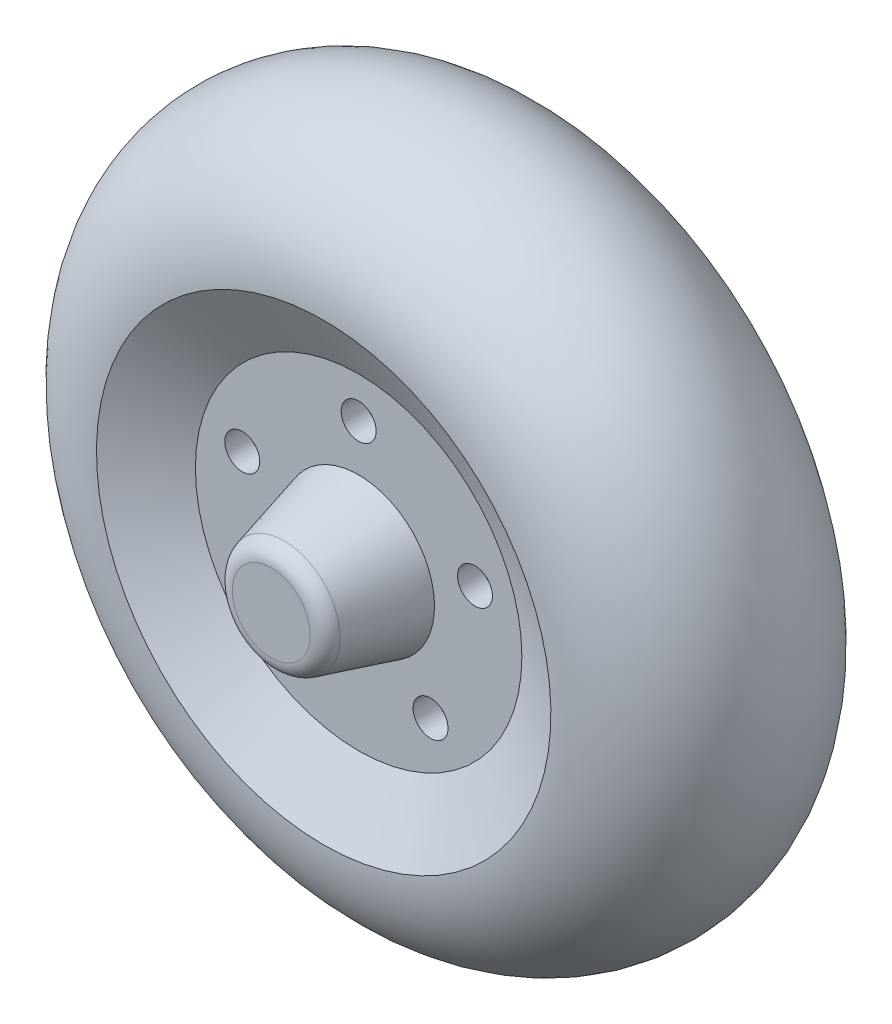
from build123d import *

# Parameters (mm, degrees)
CONG_1_R                = 5
ESQUISSE2_R             = 5
ENL_V_MAT_EXTRU_1_DEPTH = 174.205080872


with BuildPart() as part:
    # Esquisse1 → Révolution1 (revolve)
    with BuildSketch(Plane(origin=(0, 0, 0), x_dir=(0, 0, -1), z_dir=(1, 0, 0)), mode=Mode.PRIVATE) as r_volution1_sk:
        with BuildLine():
            Line((-50, 15), (-50, 0))
            Line((-50, 0), (-43, 0))
            Line((-43, 0), (-43, 9.628711084))
            Line((-43, 9.628711084), (-18, 16.327440895))
            Line((-18, 16.327440895), (-18, 48.486432404))
            Line((-18, 48.486432404), (-27.948718552, 66.693851029))
            ThreePointArc((-27.948718552, 66.693851029), (0, 93), (27.948718552, 66.693851029))
            Line((27.948718552, 66.693851029), (18, 48.486432404))
            Line((18, 48.486432404), (18, 16.327440895))
            Line((18, 16.327440895), (43, 9.628711084))
            Line((43, 9.628711084), (43, 0))
            Line((43, 0), (50, 0))
            Line((50, 0), (50, 15))
            Line((50, 15), (25, 21.698729811))
            Line((25, 21.698729811), (25, 46.698729811))
            Line((25, 46.698729811), (35, 65))
            ThreePointArc((35, 65), (0, 100), (-35, 65))
            Line((-35, 65), (-25, 46.698729811))
            Line((-25, 46.698729811), (-25, 21.698729811))
            Line((-25, 21.698729811), (-50, 15))
        make_face()
    revolve(r_volution1_sk.sketch.rotate(Axis((0, 0, 0), (0, 0, -1)), 180), axis=Axis((0, 0, 0), (0, 0, -1)))

    # Congé1
    cong_1_edges = [part.edges().sort_by_distance(p)[0] for p in [
        (0, 15, -50),
        (0, 15, 50),
    ]]
    fillet(cong_1_edges, radius=CONG_1_R)

    # Esquisse2 → Enlèv. mat.-Extru.1 (cut, through all)
    with BuildSketch(Plane(origin=(0, 0, -50), x_dir=(-1, 0, 0), z_dir=(0, 0, -1))):
        with Locations(Location((0, 35, 0), (0, 0, 90))):
            Circle(ESQUISSE2_R)
        with Locations(Location((33.28697807, 10.815594803, 0), (0, 0, 90))):
            Circle(ESQUISSE2_R)
        with Locations(Location((20.57248383, -28.315594803, 0), (0, 0, 90))):
            Circle(ESQUISSE2_R)
        with Locations(Location((-20.57248383, -28.315594803, 0), (0, 0, 90))):
            Circle(ESQUISSE2_R)
        with Locations(Location((-33.28697807, 10.815594803, 0), (0, 0, 90))):
            Circle(ESQUISSE2_R)
    extrude(amount=-ENL_V_MAT_EXTRU_1_DEPTH, mode=Mode.SUBTRACT)


solid = part.part
